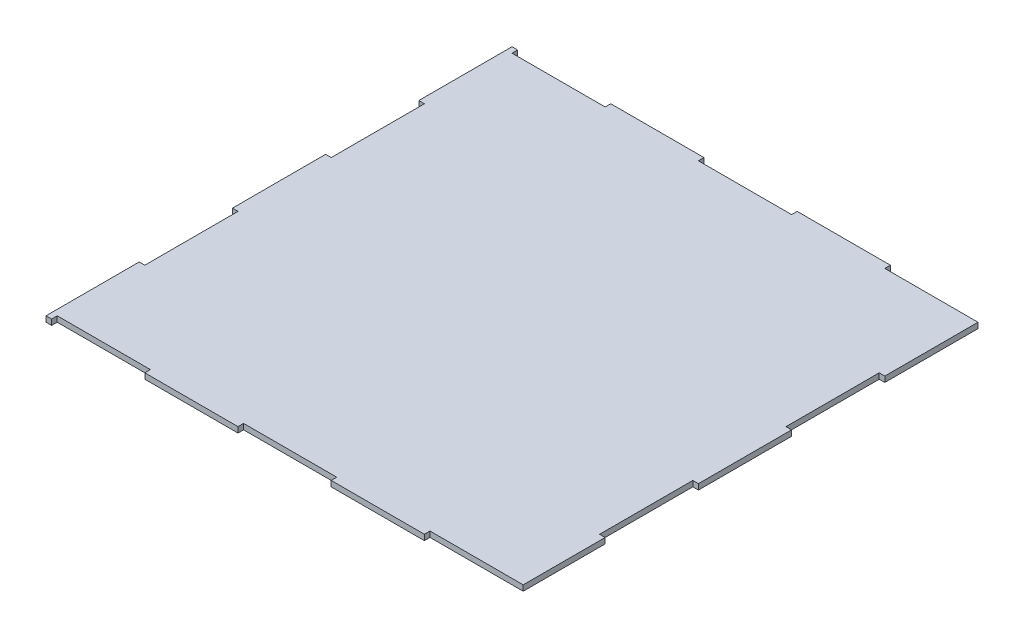
from build123d import *

# Parameters (mm, degrees)
BOSS_EXTRUDE1_DEPTH = 3


with BuildPart() as part:
    # Sketch1 → Boss-Extrude1 (new body)
    with BuildSketch(Plane(origin=(0, 0, 0), x_dir=(1, 0, 0), z_dir=(0, 1, 0))):
        Polygon((253, -53), (253, -3), (203, -3), (203, 0), (153, 0), (153, -3), (103, -3), (103, 0), (53, 0), (53, -3), (3, -3), (3, 0), (0, 0), (0, -50), (3, -50), (3, -100), (0, -100), (0, -150), (3, -150), (3, -200), (0, -200), (0, -250), (3, -250), (3, -247), (53, -247), (53, -250), (103, -250), (103, -247), (153, -247), (153, -250), (203, -250), (203, -247), (253, -247), (253, -203), (250, -203), (250, -153), (253, -153), (253, -103), (250, -103), (250, -53), align=None)
    extrude(amount=BOSS_EXTRUDE1_DEPTH)


solid = part.part
